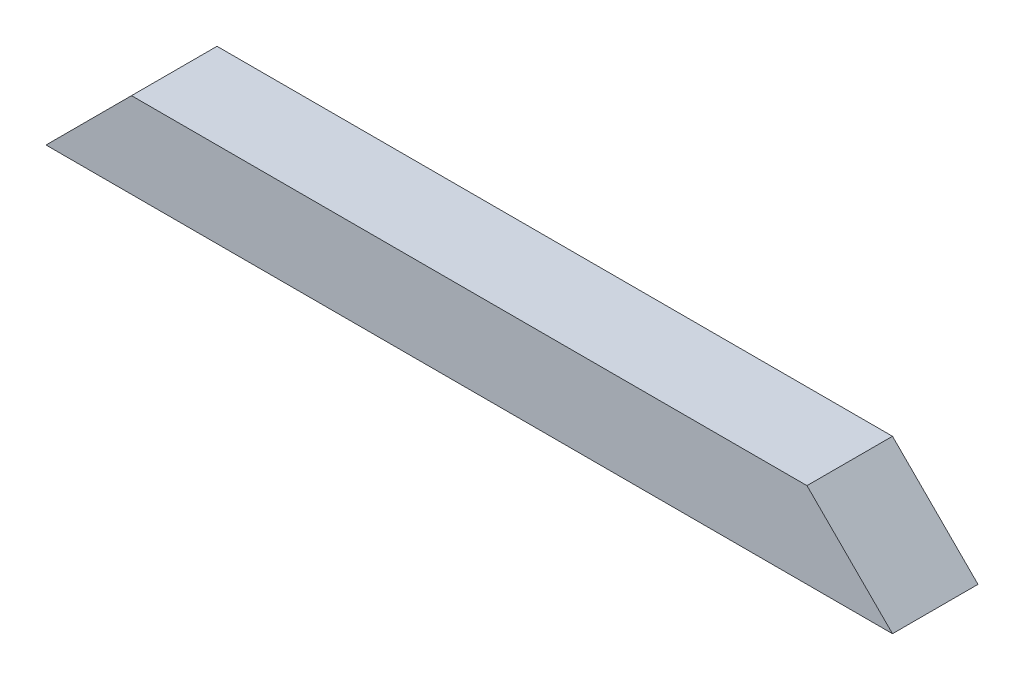
from build123d import *

# Parameters (mm, degrees)
AUFSATZ_LINEAR_AUSTRAGEN1_DEPTH = 40


with BuildPart() as part:
    # Skizze1 → Aufsatz-Linear austragen1 (new body)
    with BuildSketch(Plane.XY):
        Polygon((0, 0), (395.979797, 0), (355.979797, 40), (40, 40), align=None)
    extrude(amount=AUFSATZ_LINEAR_AUSTRAGEN1_DEPTH)


solid = part.part
